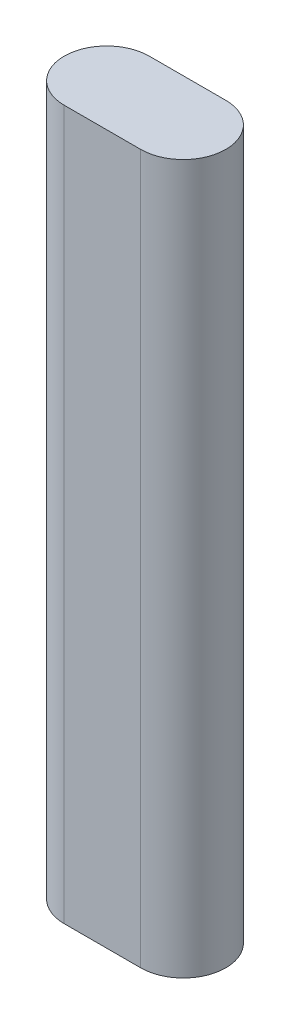
from build123d import *

# Parameters (mm, degrees)
BOSS_EXTRUDE1_DEPTH = 2500


with BuildPart() as part:
    # Sketch1 → Boss-Extrude1 (new body)
    with BuildSketch(Plane(origin=(0, 0, 0), x_dir=(1, 0, 0), z_dir=(0, 1, 0))):
        with BuildLine():
            Line((135, -150), (-135, -150))
            ThreePointArc((-135, -150), (-285, 0), (-135, 150))
            Line((-135, 150), (135, 150))
            ThreePointArc((135, 150), (285, 0), (135, -150))
        make_face()
    extrude(amount=BOSS_EXTRUDE1_DEPTH)


solid = part.part
